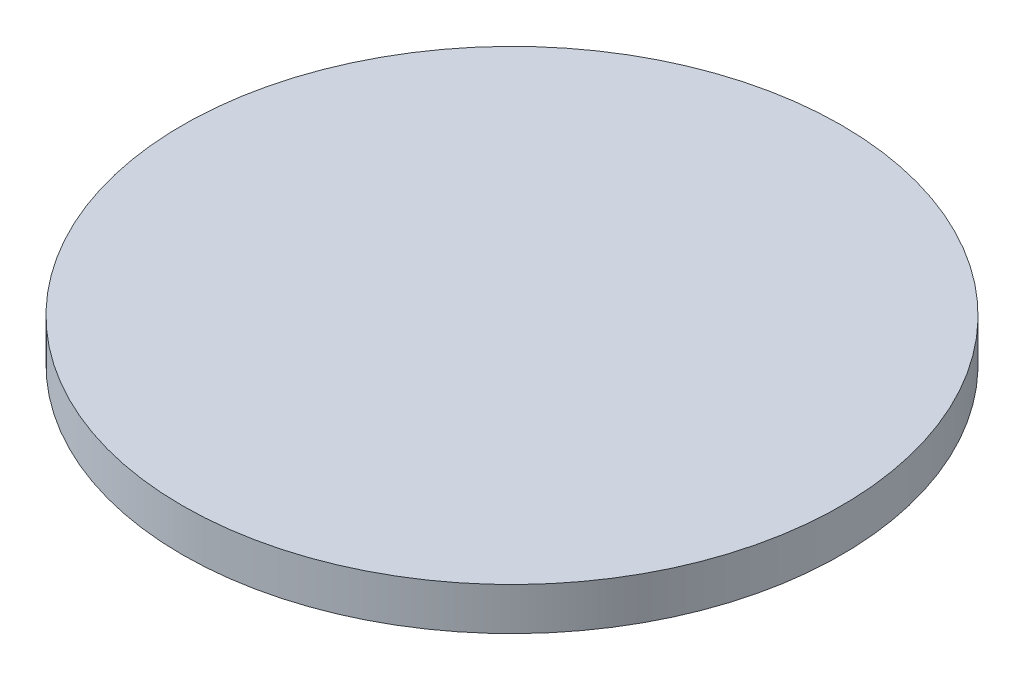
from build123d import *

# Parameters (mm, degrees)
SKETCH1_R           = 49.2125
BOSS_EXTRUDE1_DEPTH = 6.35


with BuildPart() as part:
    # Sketch1 → Boss-Extrude1 (new body)
    with BuildSketch(Plane(origin=(0, 0, 0), x_dir=(1, 0, 0), z_dir=(0, 1, 0))):
        with Locations(Location((-90.676229807, 17.292422031, 0), (0, 0, 270))):
            Circle(SKETCH1_R)
    extrude(amount=BOSS_EXTRUDE1_DEPTH)


solid = part.part
